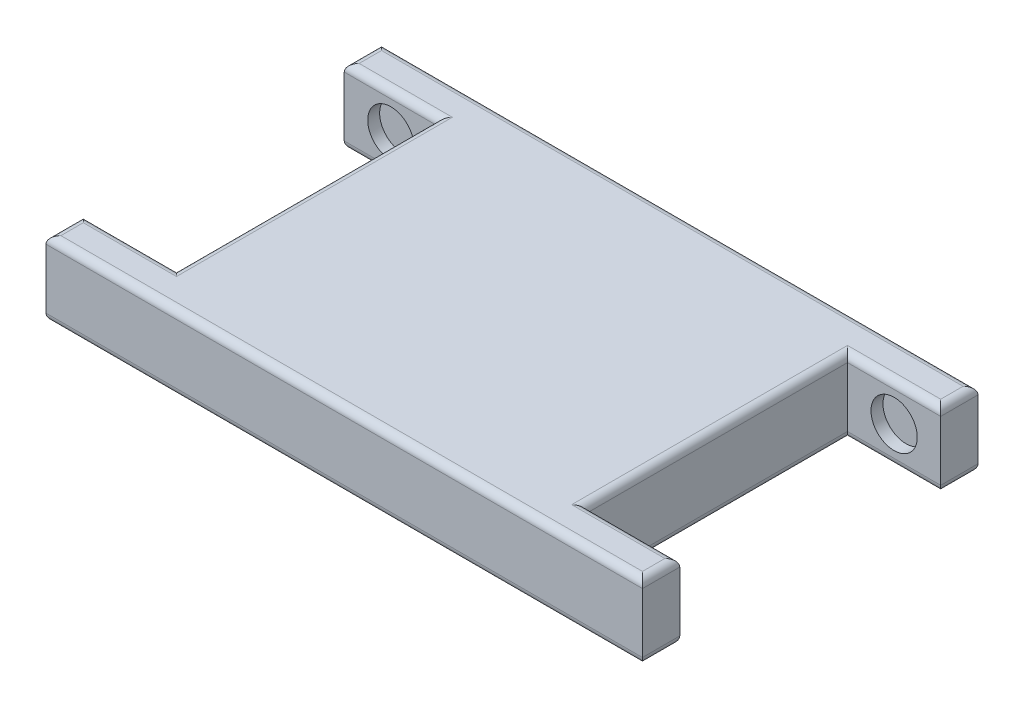
from build123d import *

# Parameters (mm, degrees)
SKETCH2_W               = 550
SKETCH2_H               = 450
BOSS_EXTRUDE1_DEPTH     = 100
SKETCH3_W               = 50
SKETCH3_H               = 100
BOSS_EXTRUDE2_DEPTH     = 125
MIRROR2_COPY_1_SKETCH_W = 50
MIRROR2_COPY_1_SKETCH_H = 100
MIRROR2_COPY_1_DEPTH    = 125
SKETCH4_R               = 31
CUT_EXTRUDE1_DEPTH      = 16
MIRROR4_COPY_1_SKETCH_R = 31
MIRROR4_COPY_1_DEPTH    = 16
FILLET4_R               = 10


with BuildPart() as part:
    # Sketch2 → Boss-Extrude1 (new body)
    with BuildSketch(Plane(origin=(0, 0, 0), x_dir=(1, 0, 0), z_dir=(0, 1, 0))):
        with Locations((111.087570621, 17.973163842)):
            Rectangle(SKETCH2_W, SKETCH2_H)
    boss_extrude1 = extrude(amount=BOSS_EXTRUDE1_DEPTH)

    # Sketch3 → Boss-Extrude2 (add)
    with BuildSketch(Plane.ZY.offset(163.912429379)):
        with Locations((-217.973163842, 50)):
            Rectangle(SKETCH3_W, SKETCH3_H)
    boss_extrude2 = extrude(amount=BOSS_EXTRUDE2_DEPTH)

    # Mirror1: Boss-Extrude2 across plane
    add(boss_extrude2.mirror(Plane(origin=(0, 0, -17.973163842), x_dir=(1, 0, 0), z_dir=(0, 0, -1))))

    # Mirror2: Boss-Extrude1, Boss-Extrude2 across plane
    add(boss_extrude1.mirror(Plane(origin=(111.087570621, 0, 0), x_dir=(0, 0, 1), z_dir=(1, 0, 0))))
    add(boss_extrude2.mirror(Plane(origin=(111.087570621, 0, 0), x_dir=(0, 0, 1), z_dir=(1, 0, 0))))

    # Mirror2 copy 1 sketch → Mirror2 copy 1 (add)
    with BuildSketch(Plane(origin=(386.087570621, 0, -35.946327684), x_dir=(0, 0, -1), z_dir=(1, 0, 0))):
        with Locations((-217.973163842, 50)):
            Rectangle(MIRROR2_COPY_1_SKETCH_W, MIRROR2_COPY_1_SKETCH_H)
    extrude(amount=MIRROR2_COPY_1_DEPTH)

    # Sketch4 → Cut-Extrude1 (cut)
    with BuildSketch(Plane(origin=(0, 0, 157.026836158), x_dir=(-1, 0, 0), z_dir=(0, 0, -1))):
        with Locations((-448.587570621, 50)):
            Circle(SKETCH4_R)
    cut_extrude1 = extrude(amount=-CUT_EXTRUDE1_DEPTH, mode=Mode.SUBTRACT)

    # Mirror3: Cut-Extrude1 across plane
    add(cut_extrude1.mirror(Plane(origin=(0, 0, -17.973163842), x_dir=(1, 0, 0), z_dir=(0, 0, -1))), mode=Mode.SUBTRACT)

    # Mirror4: Cut-Extrude1 across plane
    add(cut_extrude1.mirror(Plane(origin=(111.087570621, 0, 0), x_dir=(0, 0, 1), z_dir=(1, 0, 0))), mode=Mode.SUBTRACT)

    # Mirror4 copy 1 sketch → Mirror4 copy 1 (cut)
    with BuildSketch(Plane(origin=(222.175141243, 0, -192.973163842), x_dir=(1, 0, 0), z_dir=(0, 0, 1))):
        with Locations((-448.587570621, 50)):
            Circle(MIRROR4_COPY_1_SKETCH_R)
    extrude(amount=-MIRROR4_COPY_1_DEPTH, mode=Mode.SUBTRACT)

    # Fillet4
    fillet4_edges = [part.edges().sort_by_distance(p)[0] for p in [
        (386.087570621, 0, -17.973163842),
        (386.087570621, 100, -17.973163842),
        (448.587570621, 0, 157.026836158),
        (448.587570621, 100, 157.026836158),
        (511.087570621, 0, 182.026836158),
        (511.087570621, 100, 182.026836158),
        (111.087570621, 100, -242.973163842),
        (-163.912429379, 0, -17.973163842),
        (-163.912429379, 100, -17.973163842),
        (-226.412429379, 0, -192.973163842),
        (-226.412429379, 100, -192.973163842),
        (-288.912429379, 0, -217.973163842),
        (-288.912429379, 100, -217.973163842),
        (-288.912429379, 100, 182.026836158),
        (-226.412429379, 100, 157.026836158),
        (-288.912429379, 0, 182.026836158),
        (-226.412429379, 0, 157.026836158),
        (111.087570621, 0, -242.973163842),
        (111.087570621, 0, 207.026836158),
        (511.087570621, 100, -217.973163842),
        (111.087570621, 100, 207.026836158),
        (448.587570621, 100, -192.973163842),
        (511.087570621, 0, -217.973163842),
        (448.587570621, 0, -192.973163842),
    ]]
    fillet(fillet4_edges, radius=FILLET4_R)


solid = part.part
